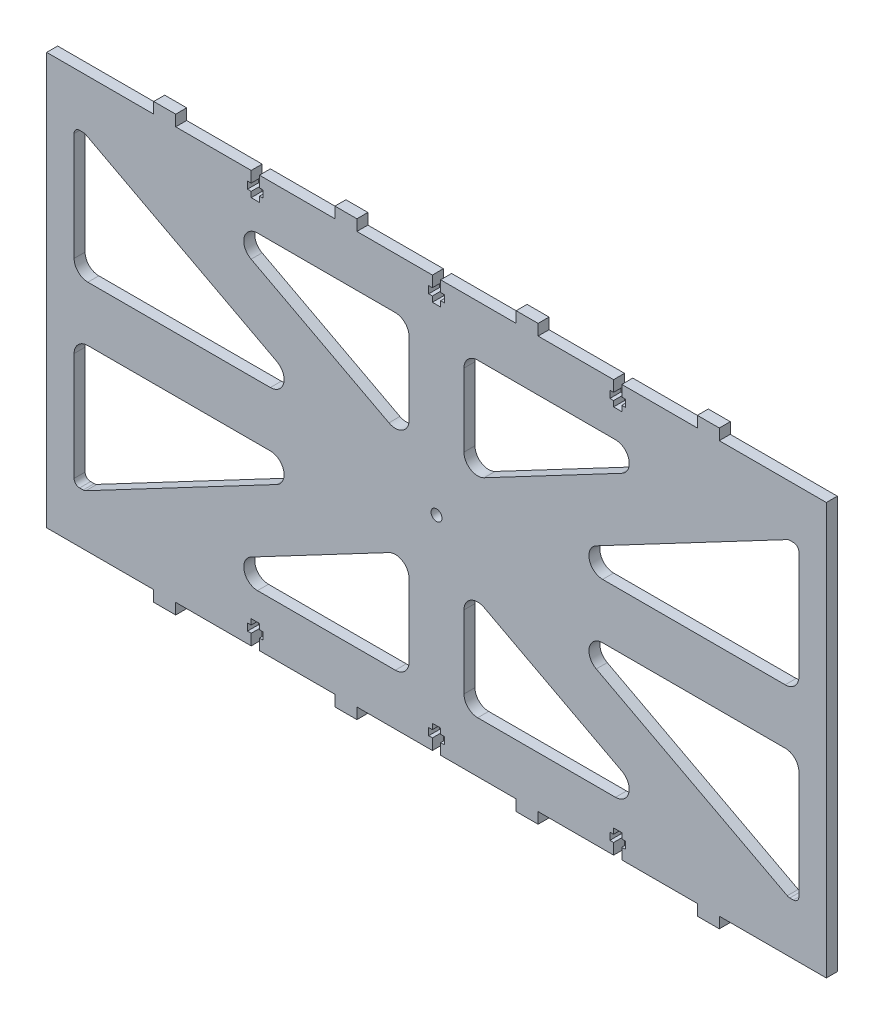
from build123d import *

# Parameters (mm, degrees)
EXTRUDE_1_DEPTH     = 4
SKETCH_4_R          = 2
CUT_EXTRUDE_1_DEPTH = 10


with BuildPart() as part:
    # 草图1 → 凸台-拉伸1 (new body)
    with BuildSketch(Plane.XY):
        Polygon((0, -4), (0, 0), (-27.5, 0), (-27.5, 4), (-35.5, 4), (-35.5, 0), (-63, 0), (-63, -4), (-61.65, -4), (-61.65, -6.6), (-63, -6.6), (-63, -8.6), (-66, -8.6), (-66, -6.6), (-67.35, -6.6), (-67.35, -4), (-66, -4), (-66, 0), (-93.5, 0), (-93.5, 4), (-101.5, 4), (-101.5, 0), (-129, 0), (-140.5, 0), (-140.5, -150), (-129, -150), (-101.5, -150), (-101.5, -154), (-93.5, -154), (-93.5, -150), (-66, -150), (-66, -146), (-67.35, -146), (-67.35, -143.4), (-66, -143.4), (-66, -141.4), (-63, -141.4), (-63, -143.4), (-61.65, -143.4), (-61.65, -146), (-63, -146), (-63, -150), (-35.5, -150), (-35.5, -154), (-27.5, -154), (-27.5, -150), (0, -150), (0, -146), (-1.35, -146), (-1.35, -143.4), (0, -143.4), (0, -141.4), (3, -141.4), (3, -143.4), (4.35, -143.4), (4.35, -146), (3, -146), (3, -150), (30.5, -150), (30.5, -154), (38.5, -154), (38.5, -150), (66, -150), (66, -146), (64.65, -146), (64.65, -143.4), (66, -143.4), (66, -141.4), (69, -141.4), (69, -143.4), (70.35, -143.4), (70.35, -146), (69, -146), (69, -150), (96.5, -150), (96.5, -154), (104.5, -154), (104.5, -150), (132, -150), (143.5, -150), (143.5, 0), (132, 0), (104.5, 0), (104.5, 4), (96.5, 4), (96.5, 0), (69, 0), (69, -4), (70.35, -4), (70.35, -6.6), (69, -6.6), (69, -8.6), (66, -8.6), (66, -6.6), (64.65, -6.6), (64.65, -4), (66, -4), (66, 0), (38.5, 0), (38.5, 4), (30.5, 4), (30.5, 0), (3, 0), (3, -4), (4.35, -4), (4.35, -6.6), (3, -6.6), (3, -8.6), (0, -8.6), (0, -6.6), (-1.35, -6.6), (-1.35, -4), align=None)
    extrude(amount=EXTRUDE_1_DEPTH)

    # 草图4 → 切除-拉伸1 (cut)
    with BuildSketch(Plane.XY.offset(4)):
        with BuildLine():
            ThreePointArc((-127.191659555, -18.6), (-126.710498265, -18.658741693), (-126.257601204, -18.831516187))
            Line((-126.257601204, -18.831516187), (-56.682761898, -55.578790468))
            ThreePointArc((-56.682761898, -55.578790468), (-54.164762011, -61.202903226), (-59.017907777, -65))
            Line((-59.017907777, -65), (-125.5, -65))
            ThreePointArc((-125.5, -65), (-129.035533906, -63.535533906), (-130.5, -60))
            Line((-130.5, -60), (-130.5, -20.6))
            ThreePointArc((-130.5, -20.6), (-129.914213562, -19.185786438), (-128.5, -18.6))
            Line((-128.5, -18.6), (-127.191659555, -18.6))
        make_face()
        with BuildLine():
            ThreePointArc((-130.5, -90), (-129.035533906, -86.464466094), (-125.5, -85))
            Line((-125.5, -85), (-59.017907777, -85))
            ThreePointArc((-59.017907777, -85), (-54.164762011, -88.797096774), (-56.682761898, -94.421209532))
            Line((-56.682761898, -94.421209532), (-126.257601204, -131.168483813))
            ThreePointArc((-126.257601204, -131.168483813), (-126.710498265, -131.341258307), (-127.191659555, -131.4))
            Line((-127.191659555, -131.4), (-128.5, -131.4))
            ThreePointArc((-128.5, -131.4), (-129.914213562, -130.814213562), (-130.5, -129.4))
            Line((-130.5, -129.4), (-130.5, -90))
        make_face()
        with BuildLine():
            Line((-15.835145879, -95.465009365), (-66.034571435, -121.978790468))
            ThreePointArc((-66.034571435, -121.978790468), (-68.552571322, -127.602903226), (-63.699425556, -131.4))
            Line((-63.699425556, -131.4), (-13.5, -131.4))
            ThreePointArc((-13.5, -131.4), (-9.964466094, -129.935533906), (-8.5, -126.4))
            Line((-8.5, -126.4), (-8.5, -99.886218897))
            ThreePointArc((-8.5, -99.886218897), (-10.918888747, -95.603945587), (-15.835145879, -95.465009365))
        make_face()
        with BuildLine():
            Line((18.835145879, -95.465009365), (69.034571435, -121.978790468))
            ThreePointArc((69.034571435, -121.978790468), (71.552571322, -127.602903226), (66.699425556, -131.4))
            Line((66.699425556, -131.4), (16.5, -131.4))
            ThreePointArc((16.5, -131.4), (12.964466094, -129.935533906), (11.5, -126.4))
            Line((11.5, -126.4), (11.5, -99.886218897))
            ThreePointArc((11.5, -99.886218897), (13.918888747, -95.603945587), (18.835145879, -95.465009365))
        make_face()
        with BuildLine():
            ThreePointArc((130.191659555, -131.4), (129.710498265, -131.341258307), (129.257601204, -131.168483813))
            Line((129.257601204, -131.168483813), (59.682761898, -94.421209532))
            ThreePointArc((59.682761898, -94.421209532), (57.164762011, -88.797096774), (62.017907777, -85))
            Line((62.017907777, -85), (128.5, -85))
            ThreePointArc((128.5, -85), (132.035533906, -86.464466094), (133.5, -90))
            Line((133.5, -90), (133.5, -129.4))
            ThreePointArc((133.5, -129.4), (132.914213562, -130.814213562), (131.5, -131.4))
            Line((131.5, -131.4), (130.191659555, -131.4))
        make_face()
        with BuildLine():
            ThreePointArc((133.5, -60), (132.035533906, -63.535533906), (128.5, -65))
            Line((128.5, -65), (62.017907777, -65))
            ThreePointArc((62.017907777, -65), (57.164762011, -61.202903226), (59.682761898, -55.578790468))
            Line((59.682761898, -55.578790468), (129.257601204, -18.831516187))
            ThreePointArc((129.257601204, -18.831516187), (129.710498265, -18.658741693), (130.191659555, -18.6))
            Line((130.191659555, -18.6), (131.5, -18.6))
            ThreePointArc((131.5, -18.6), (132.914213562, -19.185786438), (133.5, -20.6))
            Line((133.5, -20.6), (133.5, -60))
        make_face()
        with BuildLine():
            Line((18.835145879, -54.534990635), (69.034571435, -28.021209532))
            ThreePointArc((69.034571435, -28.021209532), (71.552571322, -22.397096774), (66.699425556, -18.6))
            Line((66.699425556, -18.6), (16.5, -18.6))
            ThreePointArc((16.5, -18.6), (12.964466094, -20.064466094), (11.5, -23.6))
            Line((11.5, -23.6), (11.5, -50.113781103))
            ThreePointArc((11.5, -50.113781103), (13.918888747, -54.396054413), (18.835145879, -54.534990635))
        make_face()
        with BuildLine():
            Line((-15.835145879, -54.534990635), (-66.034571435, -28.021209532))
            ThreePointArc((-66.034571435, -28.021209532), (-68.552571322, -22.397096774), (-63.699425556, -18.6))
            Line((-63.699425556, -18.6), (-13.5, -18.6))
            ThreePointArc((-13.5, -18.6), (-9.964466094, -20.064466094), (-8.5, -23.6))
            Line((-8.5, -23.6), (-8.5, -50.113781103))
            ThreePointArc((-8.5, -50.113781103), (-10.918888747, -54.396054413), (-15.835145879, -54.534990635))
        make_face()
        with Locations((1.5, -75)):
            Circle(SKETCH_4_R)
    extrude(amount=-CUT_EXTRUDE_1_DEPTH, mode=Mode.SUBTRACT)


solid = part.part
